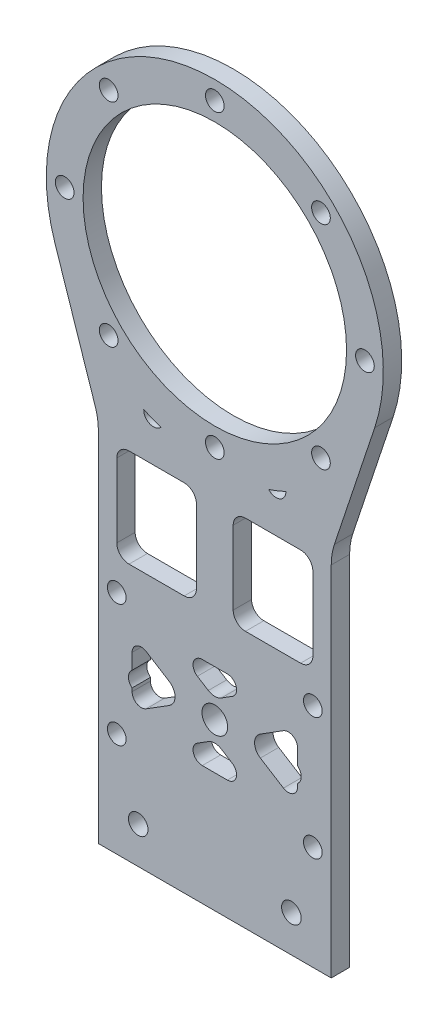
from build123d import *

# Parameters (mm, degrees)
EXTRUDE_1_DEPTH     = 3
SKETCH_2_R          = 21.5
CUT_EXTRUDE_1_DEPTH = 3
SKETCH_3_R          = 1.525
CUT_EXTRUDE_2_DEPTH = 3
SKETCH_4_W          = 38
SKETCH_4_H          = 60
SKETCH_4_R          = 1.6
EXTRUDE_2_DEPTH     = 3
SKETCH_13_R         = 1.525
CUT_EXTRUDE_7_DEPTH = 10
SKETCH_15_W         = 13
SKETCH_15_H         = 16
CUT_EXTRUDE_8_DEPTH = 10
FILLET_2_R          = 2
FILLET_3_R          = 1.5
SKETCH_16_R         = 2.1
CUT_EXTRUDE_9_DEPTH = 3
SKETCH_11_R         = 1.6
CUT_EXTRUDE_5_DEPTH = 10
CUT_EXTRUDE_START   = -10
CUT_EXTRUDE_3_DEPTH = 10
FILLET_1_R          = 10


with BuildPart() as part:
    # 草图1 → 凸台-拉伸1 (new body)
    with BuildSketch(Plane.XY):
        with BuildLine():
            Line((-19, -30), (19, -30))
            Line((19, -30), (26.093362093, -8.682537341))
            ThreePointArc((26.093362093, -8.682537341), (0, 27.5), (-26.093362093, -8.682537341))
            Line((-26.093362093, -8.682537341), (-19, -30))
        make_face()
    extrude(amount=EXTRUDE_1_DEPTH)

    # 草图2 → 切除-拉伸1 (cut)
    with BuildSketch(Plane.XY.offset(3)):
        Circle(SKETCH_2_R)
    extrude(amount=-CUT_EXTRUDE_1_DEPTH, mode=Mode.SUBTRACT)

    # 草图3 → 切除-拉伸2 (cut)
    with BuildSketch(Plane.XY.offset(3)):
        with Locations((17.324116139, 17.324116139)):
            Circle(SKETCH_3_R)
        with Locations((24.5, 0)):
            Circle(SKETCH_3_R)
        with Locations((17.324116139, -17.324116139)):
            Circle(SKETCH_3_R)
        with Locations((0, -24.5)):
            Circle(SKETCH_3_R)
        with Locations((-17.324116139, -17.324116139)):
            Circle(SKETCH_3_R)
        with Locations((-24.5, 0)):
            Circle(SKETCH_3_R)
        with Locations((-17.324116139, 17.324116139)):
            Circle(SKETCH_3_R)
        with Locations((0, 24.5)):
            Circle(SKETCH_3_R)
    extrude(amount=-CUT_EXTRUDE_2_DEPTH, mode=Mode.SUBTRACT)

    # 草图4 → 凸台-拉伸2 (add)
    with BuildSketch(Plane.XY.offset(3)):
        with Locations((0, -60)):
            Rectangle(SKETCH_4_W, SKETCH_4_H)
        with Locations((-12.5, -84)):
            Circle(SKETCH_4_R, mode=Mode.SUBTRACT)
        with Locations((12.5, -84)):
            Circle(SKETCH_4_R, mode=Mode.SUBTRACT)
    extrude(amount=-EXTRUDE_2_DEPTH)

    # 草图13 → 切除-拉伸7 (cut)
    with BuildSketch(Plane(origin=(0, 0, 0), x_dir=(-1, 0, 0), z_dir=(0, 0, -1))):
        with Locations((16, -73)):
            Circle(SKETCH_13_R)
        with Locations((16, -53)):
            Circle(SKETCH_13_R)
        with Locations((-16, -53)):
            Circle(SKETCH_13_R)
        with Locations((-16, -73)):
            Circle(SKETCH_13_R)
    extrude(amount=-CUT_EXTRUDE_7_DEPTH, mode=Mode.SUBTRACT)

    # 草图15 → 切除-拉伸8 (cut)
    with BuildSketch(Plane(origin=(0, 0, 0), x_dir=(-1, 0, 0), z_dir=(0, 0, -1))):
        with Locations((-9.5, -40)):
            Rectangle(SKETCH_15_W, SKETCH_15_H)
        with Locations((9.5, -40)):
            Rectangle(SKETCH_15_W, SKETCH_15_H)
        Polygon((7.283009434, -55.5), (-7.283009434, -55.5), (0, -60.051880896), align=None)
        Polygon((-4.716990566, -63), (-13.5, -57.510619104), (-13.5, -68.489380896), align=None)
        Polygon((7.283009434, -70.5), (0, -65.948119104), (-7.283009434, -70.5), align=None)
        Polygon((13.5, -57.510619104), (4.716990566, -63), (13.5, -68.489380896), align=None)
    extrude(amount=-CUT_EXTRUDE_8_DEPTH, mode=Mode.SUBTRACT)

    # 圆角2
    fillet_2_edges = [part.edges().sort_by_distance(p)[0] for p in [
        (4.716990566, -63, 1.5),
        (0, -65.948119104, 1.5),
        (0, -60.051880896, 1.5),
        (-3, -32, 1.5),
        (-16, -32, 1.5),
        (-16, -48, 1.5),
        (-3, -48, 1.5),
        (-4.716990566, -63, 1.5),
        (16, -32, 1.5),
        (3, -32, 1.5),
        (3, -48, 1.5),
        (16, -48, 1.5),
    ]]
    fillet(fillet_2_edges, radius=FILLET_2_R)

    # 圆角3
    fillet_3_edges = [part.edges().sort_by_distance(p)[0] for p in [
        (13.5, -68.489380896, 1.5),
        (13.5, -57.510619104, 1.5),
        (7.283009434, -70.5, 1.5),
        (-7.283009434, -70.5, 1.5),
        (7.283009434, -55.5, 1.5),
        (-7.283009434, -55.5, 1.5),
        (-13.5, -68.489380896, 1.5),
        (-13.5, -57.510619104, 1.5),
    ]]
    fillet(fillet_3_edges, radius=FILLET_3_R)

    # 草图16 → 切除-拉伸9 (cut)
    with BuildSketch(Plane(origin=(0, 0, 0), x_dir=(-1, 0, 0), z_dir=(0, 0, -1))):
        with Locations((0, -63)):
            Circle(SKETCH_16_R)
    extrude(amount=-CUT_EXTRUDE_9_DEPTH, mode=Mode.SUBTRACT)

    # 草图11 → 切除-拉伸5 (cut)
    with BuildSketch(Plane.XY.offset(3)):
        with Locations((-12.5, -64)):
            Circle(SKETCH_11_R)
        with Locations((12.5, -64)):
            Circle(SKETCH_11_R)
    extrude(amount=-CUT_EXTRUDE_5_DEPTH, mode=Mode.SUBTRACT)

    # 草图5 → 切除-拉伸3 (cut)
    with BuildSketch(Plane.XY.offset(3).offset(CUT_EXTRUDE_START)):
        with BuildLine():
            ThreePointArc((8.797072002, -26.054971199), (10.594225082, -26.485562705), (11.598652136, -24.934339146))
            ThreePointArc((11.598652136, -24.934339146), (10.2132436, -25.533108999), (8.797072002, -26.054971199))
        make_face()
        with BuildLine():
            ThreePointArc((-8.797072002, -26.054971199), (-10.2132436, -25.533108999), (-11.598652136, -24.934339146))
            ThreePointArc((-11.598652136, -24.934339146), (-10.594225082, -26.485562705), (-8.797072002, -26.054971199))
        make_face()
    extrude(amount=CUT_EXTRUDE_3_DEPTH, mode=Mode.SUBTRACT)

    # 圆角1
    fillet_1_edges = [part.edges().sort_by_distance(p)[0] for p in [
        (19, -30, 1.5),
        (-19, -30, 1.5),
    ]]
    fillet(fillet_1_edges, radius=FILLET_1_R)


solid = part.part
